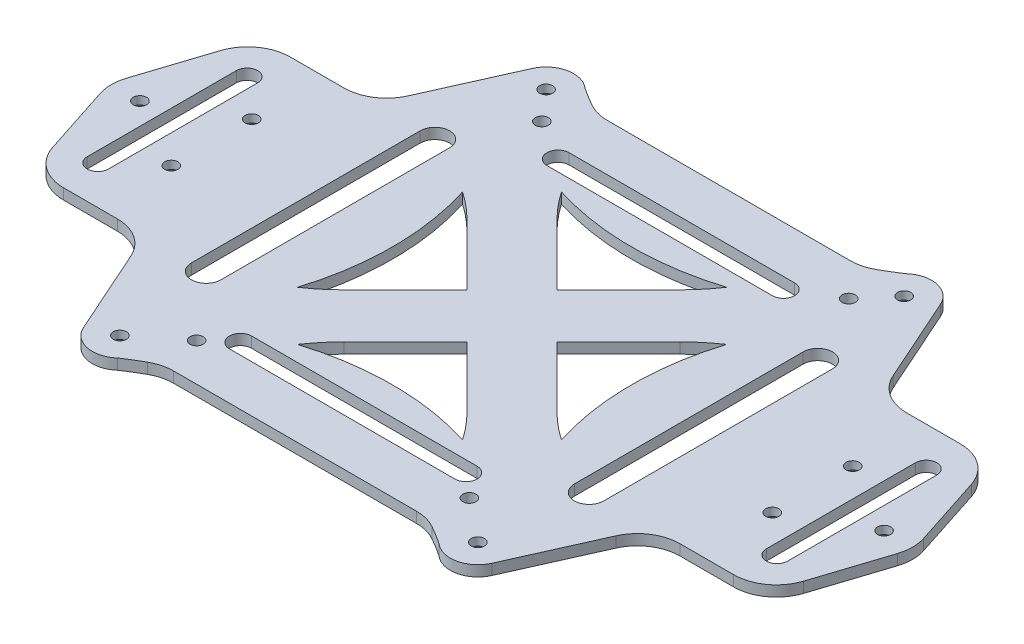
from build123d import *
from OCP.BRepFilletAPI import BRepFilletAPI_MakeChamfer

# Parameters (mm, degrees)
SKETCH_1_R      = 1.55
EXTRUDE_1_DEPTH = 2.5
FILLET_1_R      = 10
CHAMFER_2_SIZE  = 0.615
CHAMFER_2_SIZE2 = 0.355070416


with BuildPart() as part:
    # 草图1 → 凸台-拉伸1 (new body)
    with BuildSketch(Plane(origin=(0, 0, 0), x_dir=(1, 0, 0), z_dir=(0, 1, 0))):
        with BuildLine():
            Line((47.899982554, 52.633397656), (59.52497064, 26.588251477))
            Line((59.52497064, 26.588251477), (85.869588061, 26.588251477))
            Line((85.869588061, 26.588251477), (94.505759306, 0))
            Line((94.505759306, 0), (85.869588061, -26.588251477))
            Line((85.869588061, -26.588251477), (59.52497064, -26.588251477))
            Line((59.52497064, -26.588251477), (47.899982554, -52.633397656))
            ThreePointArc((47.899982554, -52.633397656), (43.362068791, -56.315801292), (37.709796983, -54.831018053))
            ThreePointArc((37.709796983, -54.831018053), (34.400449937, -52.764318952), (30.978168019, -50.89055015))
            Line((30.978168019, -50.89055015), (-30.978168019, -50.89055015))
            ThreePointArc((-30.978168019, -50.89055015), (-34.400449937, -52.764318952), (-37.709796983, -54.831018053))
            ThreePointArc((-37.709796983, -54.831018053), (-43.362068791, -56.315801292), (-47.899982554, -52.633397656))
            Line((-47.899982554, -52.633397656), (-59.52497064, -26.588251477))
            Line((-59.52497064, -26.588251477), (-85.869588061, -26.588251477))
            Line((-85.869588061, -26.588251477), (-94.505759306, 0))
            Line((-94.505759306, 0), (-85.869588061, 26.588251477))
            Line((-85.869588061, 26.588251477), (-59.52497064, 26.588251477))
            Line((-59.52497064, 26.588251477), (-47.899982554, 52.633397656))
            ThreePointArc((-47.899982554, 52.633397656), (-43.362068791, 56.315801292), (-37.709796983, 54.831018053))
            ThreePointArc((-37.709796983, 54.831018053), (-34.400449937, 52.764318952), (-30.978168019, 50.89055015))
            Line((-30.978168019, 50.89055015), (30.978168019, 50.89055015))
            ThreePointArc((30.978168019, 50.89055015), (34.400449937, 52.764318952), (37.709796983, 54.831018053))
            ThreePointArc((37.709796983, 54.831018053), (43.362068791, 56.315801292), (47.899982554, 52.633397656))
        make_face()
        with Locations(Location((42, 50, 0), (0, 0, 270))):
            Circle(SKETCH_1_R, mode=Mode.SUBTRACT)
        with Locations(Location((42, -50, 0), (0, 0, 90))):
            Circle(SKETCH_1_R, mode=Mode.SUBTRACT)
        with Locations(Location((-42, -50, 0), (0, 0, 270))):
            Circle(SKETCH_1_R, mode=Mode.SUBTRACT)
        with Locations(Location((-42, 50, 0), (0, 0, 90))):
            Circle(SKETCH_1_R, mode=Mode.SUBTRACT)
        with Locations(Location((36, 43, 0), (0, 0, 270))):
            Circle(SKETCH_1_R, mode=Mode.SUBTRACT)
        with Locations(Location((32, -42, 0), (0, 0, 270))):
            Circle(SKETCH_1_R, mode=Mode.SUBTRACT)
        with Locations(Location((-32, -42, 0), (0, 0, 90))):
            Circle(SKETCH_1_R, mode=Mode.SUBTRACT)
        with Locations(Location((-36, 43, 0), (0, 0, 90))):
            Circle(SKETCH_1_R, mode=Mode.SUBTRACT)
        with Locations(Location((70.5, 9.435839055, 0), (0, 0, 270))):
            Circle(SKETCH_1_R, mode=Mode.SUBTRACT)
        with Locations(Location((70.5, -9.435839055, 0), (0, 0, 90))):
            Circle(SKETCH_1_R, mode=Mode.SUBTRACT)
        with Locations(Location((-70.5, -9.435839055, 0), (0, 0, 270))):
            Circle(SKETCH_1_R, mode=Mode.SUBTRACT)
        with Locations(Location((-70.5, 9.435839055, 0), (0, 0, 90))):
            Circle(SKETCH_1_R, mode=Mode.SUBTRACT)
        with Locations(Location((87.3, 0, 0), (0, 0, 270))):
            Circle(SKETCH_1_R, mode=Mode.SUBTRACT)
        with Locations(Location((-87.3, 0, 0), (0, 0, 90))):
            Circle(SKETCH_1_R, mode=Mode.SUBTRACT)
        with BuildLine():
            Line((77.169642998, -17.5), (77.169642998, 17.5))
            ThreePointArc((77.169642998, 17.5), (79.669642998, 20), (82.169642998, 17.5))
            Line((82.169642998, 17.5), (82.169642998, -17.5))
            ThreePointArc((82.169642998, -17.5), (79.669642998, -20), (77.169642998, -17.5))
        make_face(mode=Mode.SUBTRACT)
        with BuildLine():
            Line((-77.169642998, -17.5), (-77.169642998, 17.5))
            ThreePointArc((-77.169642998, 17.5), (-79.669642998, 20), (-82.169642998, 17.5))
            Line((-82.169642998, 17.5), (-82.169642998, -17.5))
            ThreePointArc((-82.169642998, -17.5), (-79.669642998, -20), (-77.169642998, -17.5))
        make_face(mode=Mode.SUBTRACT)
        with BuildLine():
            Line((-24.995975583, 14.429581723), (-10.56639386, 0))
            Line((-10.56639386, 0), (-24.995975583, -14.429581723))
            ThreePointArc((-24.995975583, -14.429581723), (-27.869597938, -17.042325553), (-30.978168019, -19.370614155))
            ThreePointArc((-30.978168019, -19.370614155), (-28.024295248, 0), (-30.978168019, 19.370614155))
            ThreePointArc((-30.978168019, 19.370614155), (-27.869597938, 17.042325553), (-24.995975583, 14.429581723))
        make_face(mode=Mode.SUBTRACT)
        with BuildLine():
            Line((14.429581723, 24.995975583), (0, 10.56639386))
            Line((0, 10.56639386), (-14.429581723, 24.995975583))
            ThreePointArc((-14.429581723, 24.995975583), (-17.042325553, 27.869597938), (-19.370614155, 30.978168019))
            ThreePointArc((-19.370614155, 30.978168019), (0, 28.024295248), (19.370614155, 30.978168019))
            ThreePointArc((19.370614155, 30.978168019), (17.042325553, 27.869597938), (14.429581723, 24.995975583))
        make_face(mode=Mode.SUBTRACT)
        with BuildLine():
            Line((24.995975583, -14.429581723), (10.56639386, 0))
            Line((10.56639386, 0), (24.995975583, 14.429581723))
            ThreePointArc((24.995975583, 14.429581723), (27.869597938, 17.042325553), (30.978168019, 19.370614155))
            ThreePointArc((30.978168019, 19.370614155), (28.024295248, 0), (30.978168019, -19.370614155))
            ThreePointArc((30.978168019, -19.370614155), (27.869597938, -17.042325553), (24.995975583, -14.429581723))
        make_face(mode=Mode.SUBTRACT)
        with BuildLine():
            Line((-14.429581723, -24.995975583), (0, -10.56639386))
            Line((0, -10.56639386), (14.429581723, -24.995975583))
            ThreePointArc((14.429581723, -24.995975583), (17.042325553, -27.869597938), (19.370614155, -30.978168019))
            ThreePointArc((19.370614155, -30.978168019), (0, -28.024295248), (-19.370614155, -30.978168019))
            ThreePointArc((-19.370614155, -30.978168019), (-17.042325553, -27.869597938), (-14.429581723, -24.995975583))
        make_face(mode=Mode.SUBTRACT)
        with BuildLine():
            Line((41.468701347, -26.829343455), (41.468701347, 26.829343455))
            ThreePointArc((41.468701347, 26.829343455), (44.919200659, 30.279842767), (48.36969997, 26.829343455))
            Line((48.36969997, 26.829343455), (48.36969997, -26.829343455))
            ThreePointArc((48.36969997, -26.829343455), (44.919200659, -30.279842767), (41.468701347, -26.829343455))
        make_face(mode=Mode.SUBTRACT)
        with BuildLine():
            Line((-26.453510137, -34.636976429), (26.453510137, -34.636976429))
            ThreePointArc((26.453510137, -34.636976429), (29.060662927, -37.244129219), (26.453510137, -39.851282009))
            Line((26.453510137, -39.851282009), (-26.453510137, -39.851282009))
            ThreePointArc((-26.453510137, -39.851282009), (-29.060662927, -37.244129219), (-26.453510137, -34.636976429))
        make_face(mode=Mode.SUBTRACT)
        with BuildLine():
            Line((-26.453510137, 34.636976429), (26.453510137, 34.636976429))
            ThreePointArc((26.453510137, 34.636976429), (29.060662927, 37.244129219), (26.453510137, 39.851282009))
            Line((26.453510137, 39.851282009), (-26.453510137, 39.851282009))
            ThreePointArc((-26.453510137, 39.851282009), (-29.060662927, 37.244129219), (-26.453510137, 34.636976429))
        make_face(mode=Mode.SUBTRACT)
        with BuildLine():
            Line((-41.468701347, -26.829343455), (-41.468701347, 26.829343455))
            ThreePointArc((-41.468701347, 26.829343455), (-44.919200659, 30.279842767), (-48.36969997, 26.829343455))
            Line((-48.36969997, 26.829343455), (-48.36969997, -26.829343455))
            ThreePointArc((-48.36969997, -26.829343455), (-44.919200659, -30.279842767), (-41.468701347, -26.829343455))
        make_face(mode=Mode.SUBTRACT)
    extrude(amount=EXTRUDE_1_DEPTH)

    # 圆角1
    fillet_1_edges = [part.edges().sort_by_distance(p)[0] for p in [
        (59.52497064, 1.25, -26.588251477),
        (85.869588061, 1.25, -26.588251477),
        (94.505759306, 1.25, 0),
        (85.869588061, 1.25, 26.588251477),
        (59.52497064, 1.25, 26.588251477),
        (30.978168019, 1.25, 50.89055015),
        (-30.978168019, 1.25, 50.89055015),
        (-59.52497064, 1.25, 26.588251477),
        (-85.869588061, 1.25, 26.588251477),
        (-94.505759306, 1.25, 0),
        (-85.869588061, 1.25, -26.588251477),
        (-59.52497064, 1.25, -26.588251477),
        (-30.978168019, 1.25, -50.89055015),
        (30.978168019, 1.25, -50.89055015),
    ]]
    fillet(fillet_1_edges, radius=FILLET_1_R)

    # 倒角2: one chamfer whose edges measure the first distance from different faces: ONE call of the kernel's chamfer builder (chamfer() names one face for all edges)
    chamfer_2_edges_1 = [part.edges().sort_by_distance(p)[0] for p in [
        (70.5, 0, 10.985839055),
    ]]
    chamfer_2_side_1 = [part.faces().sort_by_distance(p)[0] for p in [
        (70.5, 1.25, 10.985839055),
    ]]
    chamfer_2_edges_2 = [part.edges().sort_by_distance(p)[0] for p in [
        (-70.5, 0, 7.885839055),
    ]]
    chamfer_2_side_2 = [part.faces().sort_by_distance(p)[0] for p in [
        (-70.5, 1.25, 7.885839055),
    ]]
    chamfer_2_edges_3 = [part.edges().sort_by_distance(p)[0] for p in [
        (70.5, 0, -10.985839055),
    ]]
    chamfer_2_side_3 = [part.faces().sort_by_distance(p)[0] for p in [
        (70.5, 1.25, -10.985839055),
    ]]
    chamfer_2_edges_4 = [part.edges().sort_by_distance(p)[0] for p in [
        (-70.5, 0, -7.885839055),
    ]]
    chamfer_2_side_4 = [part.faces().sort_by_distance(p)[0] for p in [
        (-70.5, 1.25, -7.885839055),
    ]]
    chamfer_2_edges_5 = [part.edges().sort_by_distance(p)[0] for p in [
        (87.3, 0, -1.55),
    ]]
    chamfer_2_side_5 = [part.faces().sort_by_distance(p)[0] for p in [
        (87.3, 1.25, -1.55),
    ]]
    chamfer_2_edges_6 = [part.edges().sort_by_distance(p)[0] for p in [
        (-87.3, 0, 1.55),
    ]]
    chamfer_2_side_6 = [part.faces().sort_by_distance(p)[0] for p in [
        (-87.3, 1.25, 1.55),
    ]]
    chamfer_2_edges_7 = [part.edges().sort_by_distance(p)[0] for p in [
        (-42, 0, 48.45),
    ]]
    chamfer_2_side_7 = [part.faces().sort_by_distance(p)[0] for p in [
        (-42, 1.25, 48.45),
    ]]
    chamfer_2_edges_8 = [part.edges().sort_by_distance(p)[0] for p in [
        (-42, 0, -48.45),
    ]]
    chamfer_2_side_8 = [part.faces().sort_by_distance(p)[0] for p in [
        (-42, 1.25, -48.45),
    ]]
    chamfer_2_edges_9 = [part.edges().sort_by_distance(p)[0] for p in [
        (42, 0, -51.55),
    ]]
    chamfer_2_side_9 = [part.faces().sort_by_distance(p)[0] for p in [
        (42, 1.25, -51.55),
    ]]
    chamfer_2_edges_10 = [part.edges().sort_by_distance(p)[0] for p in [
        (42, 0, 51.55),
    ]]
    chamfer_2_side_10 = [part.faces().sort_by_distance(p)[0] for p in [
        (42, 1.25, 51.55),
    ]]
    chamfer_2 = BRepFilletAPI_MakeChamfer(part.part.solid().wrapped)
    for e in chamfer_2_edges_1:
        chamfer_2.Add(CHAMFER_2_SIZE, CHAMFER_2_SIZE2, e.wrapped, chamfer_2_side_1[0].wrapped)  # the first distance lies on this face
    for e in chamfer_2_edges_2:
        chamfer_2.Add(CHAMFER_2_SIZE, CHAMFER_2_SIZE2, e.wrapped, chamfer_2_side_2[0].wrapped)  # the first distance lies on this face
    for e in chamfer_2_edges_3:
        chamfer_2.Add(CHAMFER_2_SIZE, CHAMFER_2_SIZE2, e.wrapped, chamfer_2_side_3[0].wrapped)  # the first distance lies on this face
    for e in chamfer_2_edges_4:
        chamfer_2.Add(CHAMFER_2_SIZE, CHAMFER_2_SIZE2, e.wrapped, chamfer_2_side_4[0].wrapped)  # the first distance lies on this face
    for e in chamfer_2_edges_5:
        chamfer_2.Add(CHAMFER_2_SIZE, CHAMFER_2_SIZE2, e.wrapped, chamfer_2_side_5[0].wrapped)  # the first distance lies on this face
    for e in chamfer_2_edges_6:
        chamfer_2.Add(CHAMFER_2_SIZE, CHAMFER_2_SIZE2, e.wrapped, chamfer_2_side_6[0].wrapped)  # the first distance lies on this face
    for e in chamfer_2_edges_7:
        chamfer_2.Add(CHAMFER_2_SIZE, CHAMFER_2_SIZE2, e.wrapped, chamfer_2_side_7[0].wrapped)  # the first distance lies on this face
    for e in chamfer_2_edges_8:
        chamfer_2.Add(CHAMFER_2_SIZE, CHAMFER_2_SIZE2, e.wrapped, chamfer_2_side_8[0].wrapped)  # the first distance lies on this face
    for e in chamfer_2_edges_9:
        chamfer_2.Add(CHAMFER_2_SIZE, CHAMFER_2_SIZE2, e.wrapped, chamfer_2_side_9[0].wrapped)  # the first distance lies on this face
    for e in chamfer_2_edges_10:
        chamfer_2.Add(CHAMFER_2_SIZE, CHAMFER_2_SIZE2, e.wrapped, chamfer_2_side_10[0].wrapped)  # the first distance lies on this face
    add(Compound.cast(chamfer_2.Shape()), mode=Mode.REPLACE)


solid = part.part
